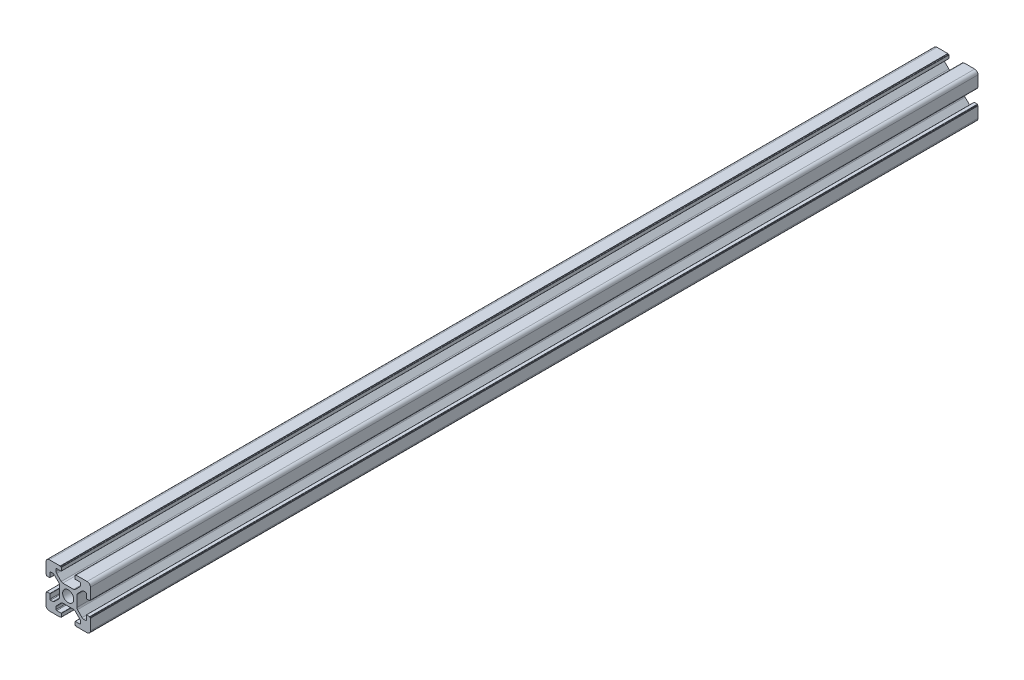
from build123d import *

# Parameters (mm, degrees)
SKETCH_1_R      = 2.5
EXTRUDE_1_DEPTH = 400
FILLET_1_R      = 1.5


with BuildPart() as part:
    # 草图1 → 凸台-拉伸1 (new body)
    with BuildSketch(Plane.XY):
        with BuildLine():
            Line((20, 13.6), (20, 20))
            Line((20, 20), (13.6, 20))
            Line((13.6, 20), (13.6, 19.8))
            Line((13.6, 19.8), (13.2, 19.8))
            ThreePointArc((13.2, 19.8), (13.129289322, 19.770710678), (13.1, 19.7))
            Line((13.1, 19.7), (13.1, 18.3))
            ThreePointArc((13.1, 18.3), (13.129289322, 18.229289322), (13.2, 18.2))
            Line((13.2, 18.2), (15.2, 18.2))
            ThreePointArc((15.2, 18.2), (15.412132034, 18.112132034), (15.5, 17.9))
            Line((15.5, 17.9), (15.5, 16.974873734))
            ThreePointArc((15.5, 16.974873734), (15.423879533, 16.592190302), (15.207106781, 16.267766953))
            Line((15.207106781, 16.267766953), (13.132233047, 14.192893219))
            ThreePointArc((13.132233047, 14.192893219), (12.807809698, 13.976120467), (12.425126266, 13.9))
            Line((12.425126266, 13.9), (7.574873734, 13.9))
            ThreePointArc((7.574873734, 13.9), (7.192190302, 13.976120467), (6.867766953, 14.192893219))
            Line((6.867766953, 14.192893219), (4.792893219, 16.267766953))
            ThreePointArc((4.792893219, 16.267766953), (4.576120467, 16.592190302), (4.5, 16.974873734))
            Line((4.5, 16.974873734), (4.5, 17.9))
            ThreePointArc((4.5, 17.9), (4.587867966, 18.112132034), (4.8, 18.2))
            Line((4.8, 18.2), (6.8, 18.2))
            ThreePointArc((6.8, 18.2), (6.870710678, 18.229289322), (6.9, 18.3))
            Line((6.9, 18.3), (6.9, 19.7))
            ThreePointArc((6.9, 19.7), (6.870710678, 19.770710678), (6.8, 19.8))
            Line((6.8, 19.8), (6.4, 19.8))
            Line((6.4, 19.8), (6.4, 20))
            Line((6.4, 20), (0, 20))
            Line((0, 20), (0, 13.6))
            Line((0, 13.6), (0.2, 13.6))
            Line((0.2, 13.6), (0.2, 13.2))
            ThreePointArc((0.2, 13.2), (0.229289322, 13.129289322), (0.3, 13.1))
            Line((0.3, 13.1), (1.7, 13.1))
            ThreePointArc((1.7, 13.1), (1.770710678, 13.129289322), (1.8, 13.2))
            Line((1.8, 13.2), (1.8, 15.2))
            ThreePointArc((1.8, 15.2), (1.887867966, 15.412132034), (2.1, 15.5))
            Line((2.1, 15.5), (3.025126266, 15.5))
            ThreePointArc((3.025126266, 15.5), (3.407809698, 15.423879533), (3.732233047, 15.207106781))
            Line((3.732233047, 15.207106781), (5.807106781, 13.132233047))
            ThreePointArc((5.807106781, 13.132233047), (6.023879533, 12.807809698), (6.1, 12.425126266))
            Line((6.1, 12.425126266), (6.1, 7.574873734))
            ThreePointArc((6.1, 7.574873734), (6.023879533, 7.192190302), (5.807106781, 6.867766953))
            Line((5.807106781, 6.867766953), (3.732233047, 4.792893219))
            ThreePointArc((3.732233047, 4.792893219), (3.407809698, 4.576120467), (3.025126266, 4.5))
            Line((3.025126266, 4.5), (2.1, 4.5))
            ThreePointArc((2.1, 4.5), (1.887867966, 4.587867966), (1.8, 4.8))
            Line((1.8, 4.8), (1.8, 6.8))
            ThreePointArc((1.8, 6.8), (1.770710678, 6.870710678), (1.7, 6.9))
            Line((1.7, 6.9), (0.3, 6.9))
            ThreePointArc((0.3, 6.9), (0.229289322, 6.870710678), (0.2, 6.8))
            Line((0.2, 6.8), (0.2, 6.4))
            Line((0.2, 6.4), (0, 6.4))
            Line((0, 6.4), (0, 0))
            Line((0, 0), (6.4, 0))
            Line((6.4, 0), (6.4, 0.2))
            Line((6.4, 0.2), (6.8, 0.2))
            ThreePointArc((6.8, 0.2), (6.870710678, 0.229289322), (6.9, 0.3))
            Line((6.9, 0.3), (6.9, 1.7))
            ThreePointArc((6.9, 1.7), (6.870710678, 1.770710678), (6.8, 1.8))
            Line((6.8, 1.8), (4.8, 1.8))
            ThreePointArc((4.8, 1.8), (4.587867966, 1.887867966), (4.5, 2.1))
            Line((4.5, 2.1), (4.5, 3.025126266))
            ThreePointArc((4.5, 3.025126266), (4.576120467, 3.407809698), (4.792893219, 3.732233047))
            Line((4.792893219, 3.732233047), (6.867766953, 5.807106781))
            ThreePointArc((6.867766953, 5.807106781), (7.192190302, 6.023879533), (7.574873734, 6.1))
            Line((7.574873734, 6.1), (12.425126266, 6.1))
            ThreePointArc((12.425126266, 6.1), (12.807809698, 6.023879533), (13.132233047, 5.807106781))
            Line((13.132233047, 5.807106781), (15.207106781, 3.732233047))
            ThreePointArc((15.207106781, 3.732233047), (15.423879533, 3.407809698), (15.5, 3.025126266))
            Line((15.5, 3.025126266), (15.5, 2.1))
            ThreePointArc((15.5, 2.1), (15.412132034, 1.887867966), (15.2, 1.8))
            Line((15.2, 1.8), (13.2, 1.8))
            ThreePointArc((13.2, 1.8), (13.129289322, 1.770710678), (13.1, 1.7))
            Line((13.1, 1.7), (13.1, 0.3))
            ThreePointArc((13.1, 0.3), (13.129289322, 0.229289322), (13.2, 0.2))
            Line((13.2, 0.2), (13.6, 0.2))
            Line((13.6, 0.2), (13.6, 0))
            Line((13.6, 0), (20, 0))
            Line((20, 0), (20, 6.4))
            Line((20, 6.4), (19.8, 6.4))
            Line((19.8, 6.4), (19.8, 6.8))
            ThreePointArc((19.8, 6.8), (19.770710678, 6.870710678), (19.7, 6.9))
            Line((19.7, 6.9), (18.3, 6.9))
            ThreePointArc((18.3, 6.9), (18.229289322, 6.870710678), (18.2, 6.8))
            Line((18.2, 6.8), (18.2, 4.8))
            ThreePointArc((18.2, 4.8), (18.112132034, 4.587867966), (17.9, 4.5))
            Line((17.9, 4.5), (16.974873734, 4.5))
            ThreePointArc((16.974873734, 4.5), (16.592190302, 4.576120467), (16.267766953, 4.792893219))
            Line((16.267766953, 4.792893219), (14.192893219, 6.867766953))
            ThreePointArc((14.192893219, 6.867766953), (13.976120467, 7.192190302), (13.9, 7.574873734))
            Line((13.9, 7.574873734), (13.9, 12.425126266))
            ThreePointArc((13.9, 12.425126266), (13.976120467, 12.807809698), (14.192893219, 13.132233047))
            Line((14.192893219, 13.132233047), (16.267766953, 15.207106781))
            ThreePointArc((16.267766953, 15.207106781), (16.592190302, 15.423879533), (16.974873734, 15.5))
            Line((16.974873734, 15.5), (17.9, 15.5))
            ThreePointArc((17.9, 15.5), (18.112132034, 15.412132034), (18.2, 15.2))
            Line((18.2, 15.2), (18.2, 13.2))
            ThreePointArc((18.2, 13.2), (18.229289322, 13.129289322), (18.3, 13.1))
            Line((18.3, 13.1), (19.7, 13.1))
            ThreePointArc((19.7, 13.1), (19.770710678, 13.129289322), (19.8, 13.2))
            Line((19.8, 13.2), (19.8, 13.6))
            Line((19.8, 13.6), (20, 13.6))
        make_face()
        with Locations((10, 10)):
            Circle(SKETCH_1_R, mode=Mode.SUBTRACT)
    extrude(amount=EXTRUDE_1_DEPTH)

    # 圆角1
    fillet_1_edges = [part.edges().sort_by_distance(p)[0] for p in [
        (0, 0, 200),
        (0, 20, 200),
        (20, 20, 200),
        (20, 0, 200),
    ]]
    fillet(fillet_1_edges, radius=FILLET_1_R)


solid = part.part
